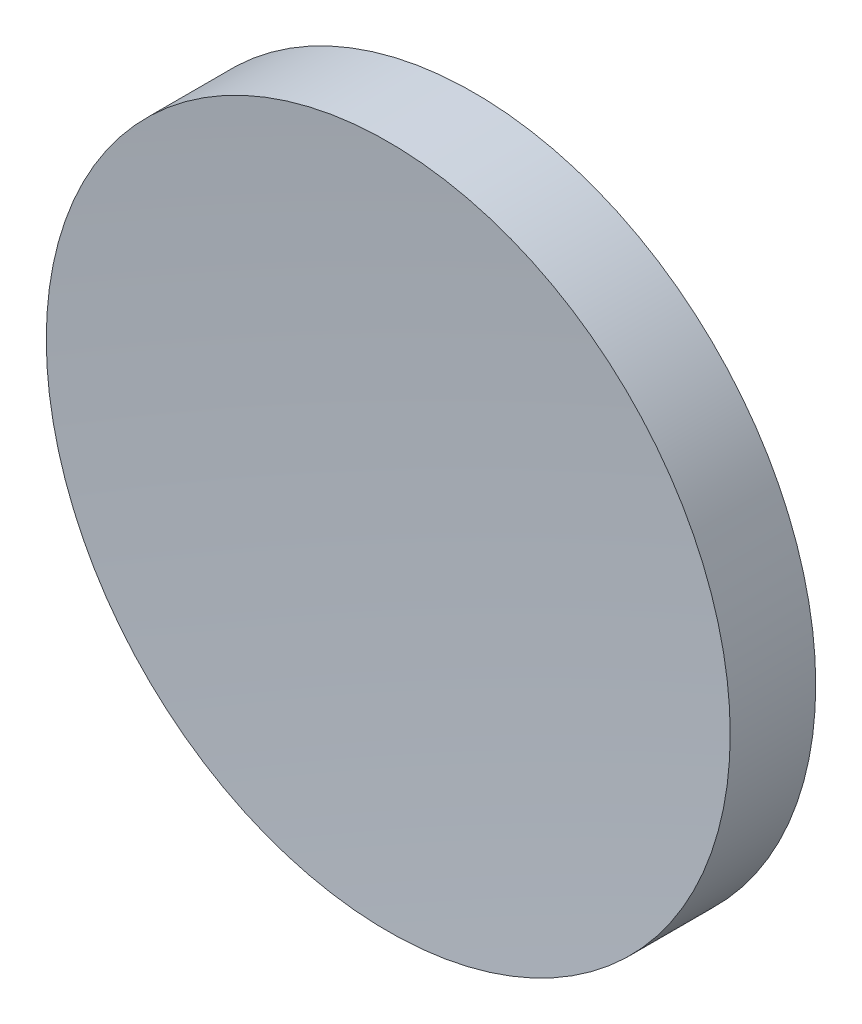
from build123d import *

# Parameters (mm, degrees)
ESQUISSE1_R        = 100
BOSS_EXTRU_1_DEPTH = 25


with BuildPart() as part:
    # Esquisse1 → Boss.-Extru.1 (new body)
    with BuildSketch(Plane.XY):
        Circle(ESQUISSE1_R)
    extrude(amount=BOSS_EXTRU_1_DEPTH)

    # Esquisse2 → Enlèvement de matière-Révolution6 (revolve, cut)
    with BuildSketch(Plane(origin=(0, 0, 0), x_dir=(1, 0, 0), z_dir=(0, 1, 0))):
        with BuildLine():
            Line((0, -1621.871942267), (0, -21.871942267))
            ThreePointArc((0, -21.871942267), (1131.370849898, -490.501092369), (1600, -1621.871942267))
            Line((1600, -1621.871942267), (0, -1621.871942267))
        make_face()
    revolve(axis=Axis((0, 0, 0), (0, 0, 1)), mode=Mode.SUBTRACT)


solid = part.part
